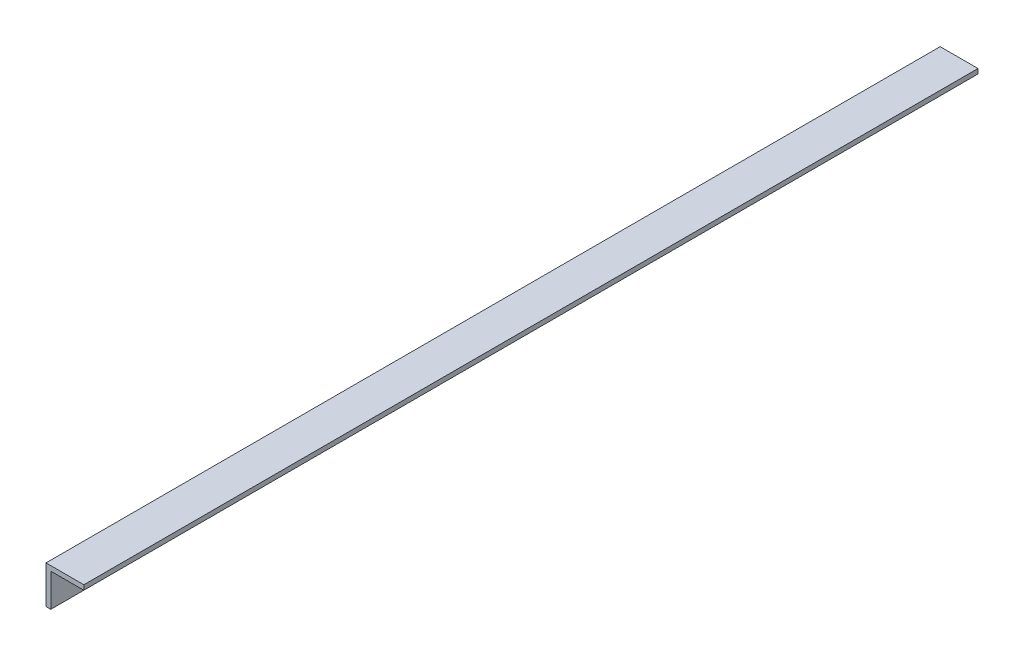
from build123d import *

# Parameters (mm, degrees)
BOSS_EXTRUDE1_DEPTH = 300


with BuildPart() as part:
    # Sketch1 → Boss-Extrude1 (new body)
    with BuildSketch(Plane.XY):
        Polygon((-13.447058824, 11.280588235), (-0.747058824, 11.280588235), (-0.747058824, 9.680588235), (-11.847058824, 9.680588235), (-11.847058824, -1.419411765), (-13.447058824, -1.419411765), align=None)
    extrude(amount=BOSS_EXTRUDE1_DEPTH)


solid = part.part
